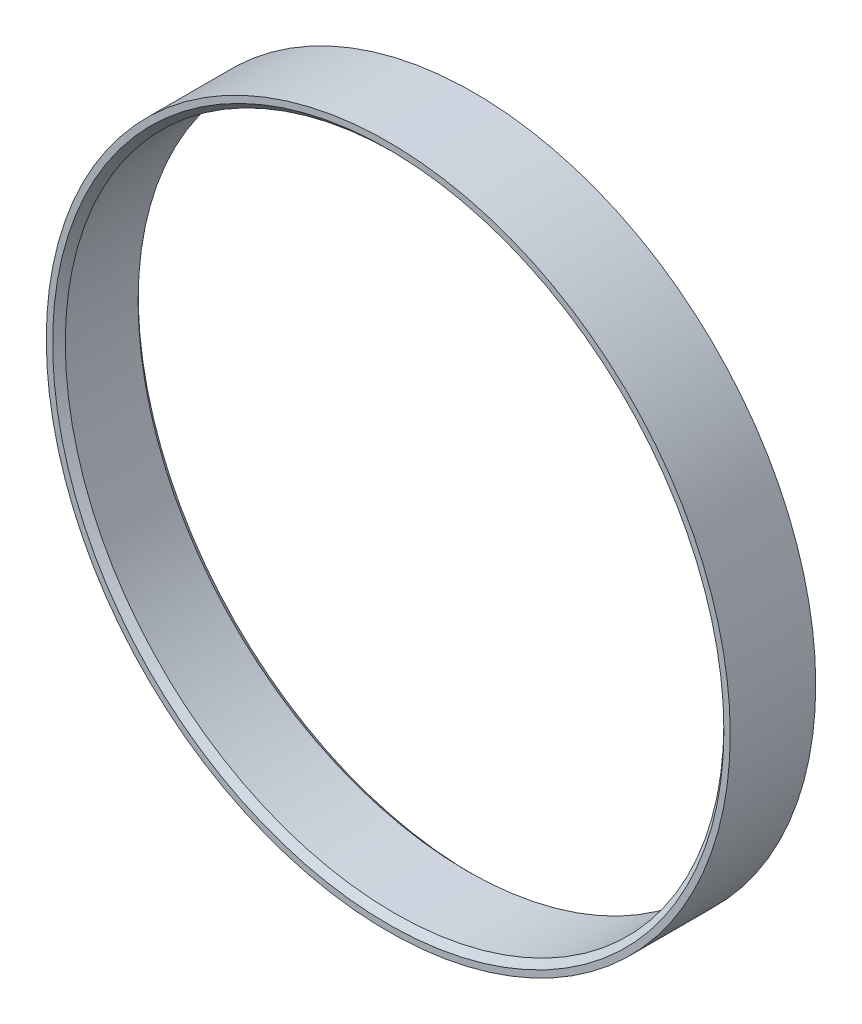
from build123d import *

# Parameters (mm, degrees)
SZKIC1_R                    = 54
SZKIC1_R_2                  = 52
DODANIE_WYCI_GNI_CIE1_DEPTH = 13.5
SFAZOWANIE1_SIZE            = 1


with BuildPart() as part:
    # Szkic1 → Dodanie-wyciągnięcie1 (new body)
    with BuildSketch(Plane.XY):
        Circle(SZKIC1_R)
        Circle(SZKIC1_R_2, mode=Mode.SUBTRACT)
    extrude(amount=DODANIE_WYCI_GNI_CIE1_DEPTH)

    # Sfazowanie1
    sfazowanie1_edges = [part.edges().sort_by_distance(p)[0] for p in [
        (-52, 0, 0),
        (-52, 0, 13.5),
    ]]
    chamfer(sfazowanie1_edges, length=SFAZOWANIE1_SIZE)


solid = part.part
